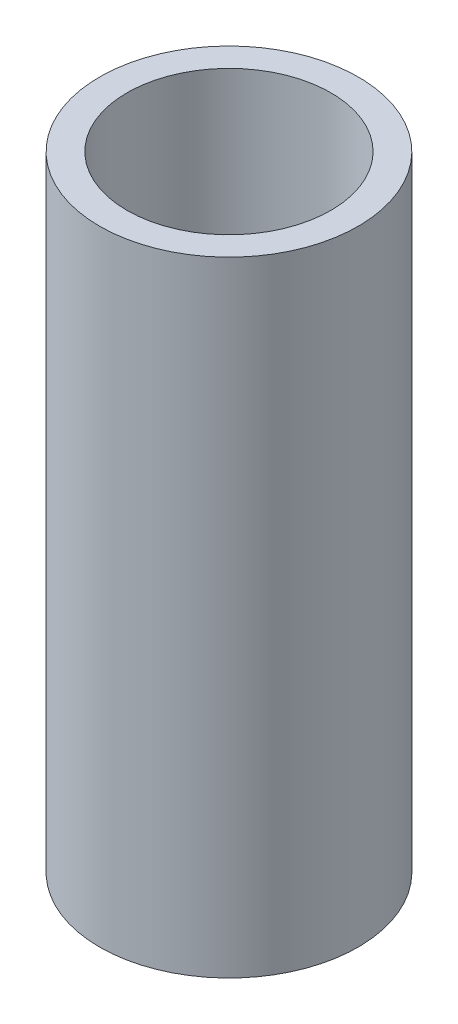
from build123d import *

# Parameters (mm, degrees)
CROQUIS1_R              = 14.5
CROQUIS1_R_2            = 11.43
SALIENTE_EXTRUIR1_DEPTH = 35


with BuildPart() as part:
    # Croquis1 → Saliente-Extruir1 (new, symmetric)
    with BuildSketch(Plane(origin=(0, 0, 0), x_dir=(1, 0, 0), z_dir=(0, 1, 0))):
        with Locations(Location((0, 0, 0), (0, 0, 270))):
            Circle(CROQUIS1_R)
        with Locations(Location((0, 0, 0), (0, 0, 270))):
            Circle(CROQUIS1_R_2, mode=Mode.SUBTRACT)
    extrude(amount=SALIENTE_EXTRUIR1_DEPTH, both=True)


solid = part.part
